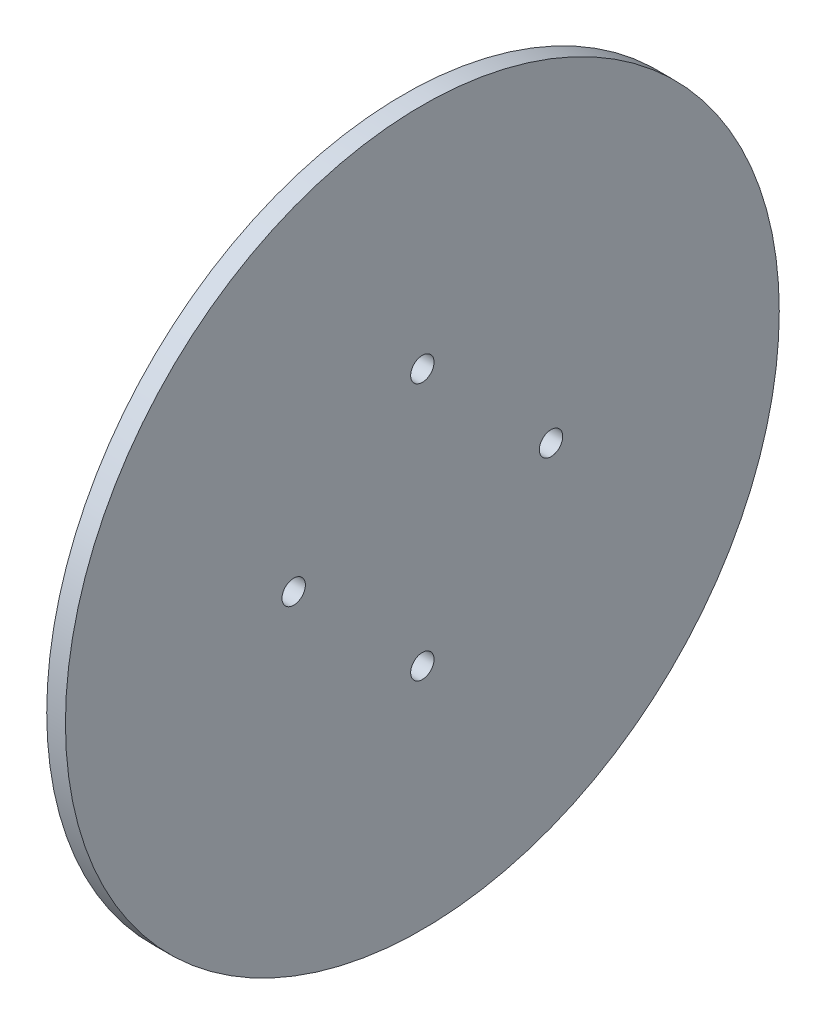
from build123d import *

# Parameters (mm, degrees)
SKETCH1_R           = 76.29
SKETCH1_R_2         = 2.5
BOSS_EXTRUDE1_DEPTH = 4


with BuildPart() as part:
    # Sketch1 → Boss-Extrude1 (new body)
    with BuildSketch(Plane(origin=(0, 0, 0), x_dir=(0, 0, -1), z_dir=(1, 0, 0))):
        Circle(SKETCH1_R)
        with Locations((0, 27.5)):
            Circle(SKETCH1_R_2, mode=Mode.SUBTRACT)
        with Locations((27.5, 0)):
            Circle(SKETCH1_R_2, mode=Mode.SUBTRACT)
        with Locations((0, -27.5)):
            Circle(SKETCH1_R_2, mode=Mode.SUBTRACT)
        with Locations((-27.5, 0)):
            Circle(SKETCH1_R_2, mode=Mode.SUBTRACT)
    extrude(amount=BOSS_EXTRUDE1_DEPTH)


solid = part.part
